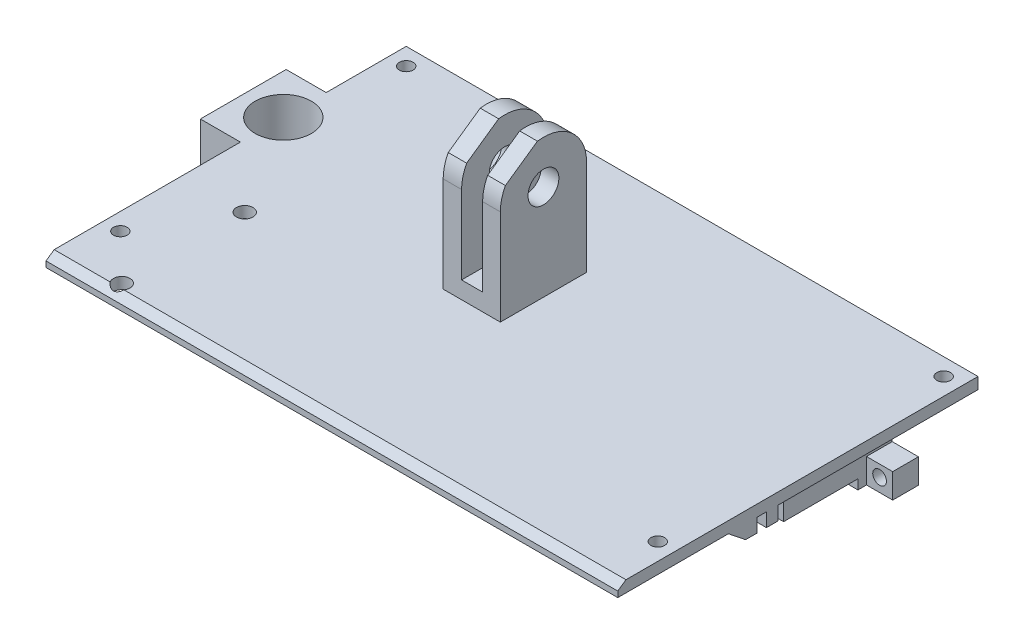
from build123d import *

# Parameters (mm, degrees)
EXTRUDE_1_DEPTH      = 3.1
SKETCH_2_W           = 3.1
SKETCH_2_H           = 15.08
SKETCH_2_W_2         = 3.68
SKETCH_2_W_3         = 3.22
EXTRUDE_2_DEPTH      = 3
SKETCH_3_W           = 3.22
SKETCH_3_H           = 15.08
EXTRUDE_3_DEPTH      = 24
SKETCH_4_R           = 2.7
CUT_EXTRUDE_1_DEPTH  = 24
SKETCH_5_W           = 90
SKETCH_5_H           = 40
SKETCH_5_W_2         = 10
SKETCH_5_H_2         = 15.08
EXTRUDE_4_DEPTH      = 2
EXTRUDE_START        = -2
EXTRUDE_6_DEPTH      = 20
CUT_EXTRUDE_2_DEPTH  = 18
SKETCH_8_W           = 2
SKETCH_8_H           = 2
EXTRUDE_8_DEPTH      = 2.4
SKETCH_9_W           = 33
SKETCH_9_H           = 2
SKETCH_9_W_2         = 3
EXTRUDE_9_DEPTH      = 2.4
SKETCH_10_W          = 2
SKETCH_10_H          = 1.65
SKETCH_10_W_2        = 10
SKETCH_10_H_2        = 2
EXTRUDE_10_DEPTH     = 15.6
SKETCH_11_W          = 12
SKETCH_11_H          = 15
EXTRUDE_11_DEPTH     = 20
CUT_EXTRUDE_3_DEPTH  = 20
EXTRUDE_12_DEPTH     = 2
CUT_EXTRUDE_4_DEPTH  = 3.65
SKETCH_15_W          = 10
SKETCH_15_H          = 15.6
CUT_EXTRUDE_5_DEPTH  = 3.65
SKETCH_17_W          = 20
SKETCH_17_H          = 8
EXTRUDE_13_DEPTH     = 2
CUT_EXTRUDE_6_DEPTH  = 2
SKETCH_19_W          = 10
SKETCH_19_H          = 2.4
CUT_EXTRUDE_7_DEPTH  = 3.65
SKETCH_20_R          = 4.71
CUT_EXTRUDE_8_DEPTH  = 20
SKETCH_21_W          = 90
SKETCH_21_H          = 2
EXTRUDE_14_DEPTH     = 10
EXTRUDE_15_DEPTH     = 10
CUT_EXTRUDE_9_DEPTH  = 2
SKETCH_24_W          = 4.58
SKETCH_24_H          = 4.62
SKETCH_24_R          = 1.2
EXTRUDE_16_DEPTH     = 4.5
SKETCH_25_W          = 4.58
SKETCH_25_H          = 4.62
SKETCH_25_R          = 1.2
EXTRUDE_17_DEPTH     = 4.5
SKETCH_26_W          = 2
SKETCH_26_H          = 1.69
EXTRUDE_18_DEPTH     = 6
SKETCH_27_W          = 4.5
SKETCH_27_H          = 3
CUT_EXTRUDE_10_DEPTH = 10
SKETCH_28_W          = 0.5
SKETCH_28_H          = 3
EXTRUDE_19_DEPTH     = 10
SKETCH_29_R          = 4.91
SKETCH_29_R_2        = 4.71
CUT_EXTRUDE_11_DEPTH = 76.91039191
EXTRUDE_20_DEPTH     = 2
SKETCH_34_W          = 4.58
SKETCH_34_H          = 4.5
CUT_EXTRUDE_12_DEPTH = 0.3
CUT_EXTRUDE_13_DEPTH = 0.3
SKETCH_36_W          = 80
SKETCH_36_H          = 7
EXTRUDE_21_DEPTH     = 2
SKETCH_37_R          = 1.45
CUT_EXTRUDE_14_DEPTH = 2
CUT_EXTRUDE_15_DEPTH = 116.616132092
EXTRUDE_22_DEPTH     = 80


with BuildPart() as part:
    # 草图1 → 凸台-拉伸1 (new body)
    with BuildSketch(Plane(origin=(0, 0, 0), x_dir=(0, 0, -1), z_dir=(1, 0, 0))):
        with BuildLine():
            ThreePointArc((2.7, 0), (1.909188309, -1.909188309), (0, -2.7))
            Line((0, -2.7), (0, -7.54))
            ThreePointArc((0, -7.54), (5.33158513, -5.33158513), (7.54, 0))
            Line((7.54, 0), (2.7, 0))
        make_face()
        with BuildLine():
            Line((0, -7.54), (0, -2.7))
            ThreePointArc((0, -2.7), (-1.909188309, -1.909188309), (-2.7, 0))
            Line((-2.7, 0), (-7.54, 0))
            ThreePointArc((-7.54, 0), (-5.33158513, -5.33158513), (0, -7.54))
        make_face()
        with BuildLine():
            ThreePointArc((2.7, 0), (1.909188309, -1.909188309), (0, -2.7))
            Line((0, -2.7), (0, -7.54))
            ThreePointArc((0, -7.54), (5.33158513, -5.33158513), (7.54, 0))
            Line((7.54, 0), (2.7, 0))
        make_face()
        with BuildLine():
            Line((0, -7.54), (0, -2.7))
            ThreePointArc((0, -2.7), (-1.909188309, -1.909188309), (-2.7, 0))
            Line((-2.7, 0), (-7.54, 0))
            ThreePointArc((-7.54, 0), (-5.33158513, -5.33158513), (0, -7.54))
        make_face()
        with BuildLine():
            Line((0, -13.7), (0, -7.54))
            ThreePointArc((0, -7.54), (-5.33158513, -5.33158513), (-7.54, 0))
            Line((-7.54, 0), (-7.54, -13.7))
            Line((-7.54, -13.7), (0, -13.7))
        make_face()
        with BuildLine():
            ThreePointArc((-2.7, 0), (0, 2.7), (2.7, 0))
            Line((2.7, 0), (7.54, 0))
            ThreePointArc((7.54, 0), (0, 7.54), (-7.54, 0))
            Line((-7.54, 0), (-2.7, 0))
        make_face()
        with BuildLine():
            ThreePointArc((7.54, 0), (5.33158513, -5.33158513), (0, -7.54))
            Line((0, -7.54), (0, -13.7))
            Line((0, -13.7), (7.54, -13.7))
            Line((7.54, -13.7), (7.54, 0))
        make_face()
    extrude(amount=EXTRUDE_1_DEPTH)

    # 草图2 → 凸台-拉伸2 (add)
    with BuildSketch(Plane.XZ.offset(13.7)):
        with Locations((1.55, 0)):
            Rectangle(SKETCH_2_W, SKETCH_2_H)
        with Locations((-1.84, 0)):
            Rectangle(SKETCH_2_W_2, SKETCH_2_H)
        with Locations((-5.29, 0)):
            Rectangle(SKETCH_2_W_3, SKETCH_2_H)
    extrude(amount=EXTRUDE_2_DEPTH)

    # 草图3 → 凸台-拉伸3 (add)
    with BuildSketch(Plane(origin=(0, -13.7, 0), x_dir=(1, 0, 0), z_dir=(0, 1, 0))):
        with Locations((-5.29, 0)):
            Rectangle(SKETCH_3_W, SKETCH_3_H)
    extrude(amount=EXTRUDE_3_DEPTH)

    # 草图4 → 切除-拉伸1 (cut)
    with BuildSketch(Plane.ZY.offset(6.9)):
        with BuildLine():
            ThreePointArc((-7.54, 0), (0, 7.54), (7.54, 0))
            Line((7.54, 0), (7.54, 10.3))
            Line((7.54, 10.3), (-7.54, 10.3))
            Line((-7.54, 10.3), (-7.54, 0))
        make_face()
        Circle(SKETCH_4_R)
    extrude(amount=-CUT_EXTRUDE_1_DEPTH, mode=Mode.SUBTRACT)

    # 草图5 → 凸台-拉伸4 (add)
    # profile 1 of 3: a face of its own
    with BuildSketch(Plane.XZ.offset(16.7)):
        with Locations((-1.9, 0)):
            Rectangle(SKETCH_5_W, SKETCH_5_H)
        with Locations((-1.9, 0)):
            Rectangle(SKETCH_5_W_2, SKETCH_5_H_2, mode=Mode.SUBTRACT)
    # profile 2 of 3: a face of its own
    with BuildSketch(Plane.XZ.offset(16.7)):
        Polygon((-6.9, 7.54), (3.1, -7.54), (-6.9, -7.54), align=None)
    # profile 3 of 3: a face of its own
    with BuildSketch(Plane.XZ.offset(16.7)):
        Polygon((-6.9, 7.54), (3.1, -7.54), (3.1, 7.54), align=None)
    extrude(amount=EXTRUDE_4_DEPTH)

    # 草图6 → 凸台-拉伸6 (add)
    with BuildSketch(Plane.XZ.offset(18.7).offset(EXTRUDE_START)):
        Polygon((-41.9, -20), (-39.9, -20), (-39.9, 1), (36.1, 1), (36.1, -20), (38.1, -20), (38.1, 3), (-41.9, 3), align=None)
        Polygon((36.1, -20), (-39.9, -20), (-41.9, -20), (-41.9, -22), (38.1, -22), (38.1, -20), align=None)
    extrude(amount=EXTRUDE_6_DEPTH)

    # 草图7 → 切除-拉伸2 (cut)
    with BuildSketch(Plane.XZ.offset(36.7)):
        Polygon((38.1, -7), (38.1, 3), (28.1, 3), (28.1, 1), (36.1, 1), (36.1, -7), align=None)
        Polygon((-39.9, -12), (-41.9, -12), (-41.9, -22), (-31.9, -22), (-31.9, -20), (-39.9, -20), align=None)
    extrude(amount=-CUT_EXTRUDE_2_DEPTH, mode=Mode.SUBTRACT)

    # 草图8 → 凸台-拉伸8 (add)
    with BuildSketch(Plane.XZ.offset(18.7)):
        Polygon((-43.9, 12.65), (-41.9, 12.65), (8.1, 12.65), (10.1, 12.65), (10.1, 14.65), (-43.9, 14.65), align=None)
        Polygon((-41.9, 11), (-41.9, 9), (10.1, 9), (10.1, 11), (8.1, 11), align=None)
        with Locations((-42.9, 10)):
            Rectangle(SKETCH_8_W, SKETCH_8_H)
    extrude(amount=EXTRUDE_8_DEPTH)

    # 草图9 → 凸台-拉伸9 (add)
    with BuildSketch(Plane.XZ.offset(21.1)):
        with Locations((26.6, 13.65)):
            Rectangle(SKETCH_9_W, SKETCH_9_H)
        with Locations((26.6, 10)):
            Rectangle(SKETCH_9_W, SKETCH_9_H)
        with Locations((-45.4, 13.65)):
            Rectangle(SKETCH_9_W_2, SKETCH_9_H)
        with Locations((-45.4, 10)):
            Rectangle(SKETCH_9_W_2, SKETCH_9_H)
    extrude(amount=-EXTRUDE_9_DEPTH)

    # 草图10 → 凸台-拉伸10 (add)
    with BuildSketch(Plane.XZ.offset(21.1)):
        Polygon((-26.9, 14.65), (-36.9, 14.65), (-36.9, 12.65), (-34.9, 12.65), (-26.9, 12.65), align=None)
        with Locations((-35.9, 11.825)):
            Rectangle(SKETCH_10_W, SKETCH_10_H)
        Polygon((-34.9, 11), (-36.9, 11), (-36.9, 9), (-26.9, 9), (-26.9, 11), align=None)
        with Locations((-41.9, 13.65)):
            Rectangle(SKETCH_10_W_2, SKETCH_10_H_2)
        with Locations((-41.9, 10)):
            Rectangle(SKETCH_10_W_2, SKETCH_10_H_2)
    extrude(amount=EXTRUDE_10_DEPTH)

    # 草图11 → 凸台-拉伸11 (add)
    with BuildSketch(Plane.XZ.offset(36.7)):
        with Locations((-47.9, -4.5)):
            Rectangle(SKETCH_11_W, SKETCH_11_H)
    extrude(amount=-EXTRUDE_11_DEPTH)

    # 草图12 → 切除-拉伸3 (cut)
    with BuildSketch(Plane.XZ.offset(36.7)):
        with BuildLine():
            ThreePointArc((-49.7077396, -1.491707571), (-49.908292429, -7.3077396), (-44.0922604, -7.508292429))
            Line((-44.0922604, -7.508292429), (-49.7077396, -1.491707571))
        make_face()
        with BuildLine():
            Line((-49.7077396, -1.491707571), (-44.0922604, -7.508292429))
            ThreePointArc((-44.0922604, -7.508292429), (-43.125938961, -6.140026912), (-42.785, -4.5))
            ThreePointArc((-42.785, -4.5), (-45.259973088, -0.725938961), (-49.7077396, -1.491707571))
        make_face()
        with BuildLine():
            ThreePointArc((-49.7077396, -1.491707571), (-49.908292429, -7.3077396), (-44.0922604, -7.508292429))
            Line((-44.0922604, -7.508292429), (-49.7077396, -1.491707571))
        make_face()
        with BuildLine():
            Line((-49.7077396, -1.491707571), (-44.0922604, -7.508292429))
            ThreePointArc((-44.0922604, -7.508292429), (-43.125938961, -6.140026912), (-42.785, -4.5))
            ThreePointArc((-42.785, -4.5), (-45.259973088, -0.725938961), (-49.7077396, -1.491707571))
        make_face()
    extrude(amount=-CUT_EXTRUDE_3_DEPTH, mode=Mode.SUBTRACT)

    # 草图13 → 凸台-拉伸12 (add)
    with BuildSketch(Plane.XZ.offset(18.7)):
        Polygon((-41.9, -20), (-46.9, -20), (-46.9, -26), (43.1, -26), (43.1, -20), (38.1, -20), (38.1, -22), (-31.9, -22), (-41.9, -22), align=None)
    extrude(amount=-EXTRUDE_12_DEPTH)

    # 草图14 → 切除-拉伸4 (cut)
    with BuildSketch(Plane.XY.offset(14.65)):
        Polygon((-46.9, -36.7), (-36.9, -36.7), (-36.9, -21.1), (-36.9, -18.7), (-46.9, -18.7), align=None)
    extrude(amount=-CUT_EXTRUDE_4_DEPTH, mode=Mode.SUBTRACT)

    # 草图15 → 切除-拉伸5 (cut)
    with BuildSketch(Plane.XY.offset(14.65)):
        with Locations((-31.9, -28.9)):
            Rectangle(SKETCH_15_W, SKETCH_15_H)
    extrude(amount=-CUT_EXTRUDE_5_DEPTH, mode=Mode.SUBTRACT)

    # 草图17 → 凸台-拉伸13 (add)
    with BuildSketch(Plane.XY.offset(11)):
        with Locations((-36.9, -40.7)):
            Rectangle(SKETCH_17_W, SKETCH_17_H)
    extrude(amount=-EXTRUDE_13_DEPTH)

    # 草图18 → 切除-拉伸6 (cut)
    with BuildSketch(Plane.XY.offset(11)):
        with BuildLine():
            ThreePointArc((-35.9, -19.5), (-37.35, -20.95), (-35.9, -22.4))
            Line((-35.9, -22.4), (-35.9, -19.5))
        make_face()
        with BuildLine():
            Line((-35.9, -19.5), (-35.9, -22.4))
            ThreePointArc((-35.9, -22.4), (-34.874695167, -21.975304833), (-34.45, -20.95))
            ThreePointArc((-34.45, -20.95), (-34.874695167, -19.924695167), (-35.9, -19.5))
        make_face()
        with BuildLine():
            ThreePointArc((-35.9, -19.5), (-37.35, -20.95), (-35.9, -22.4))
            Line((-35.9, -22.4), (-35.9, -19.5))
        make_face()
        with BuildLine():
            Line((-35.9, -19.5), (-35.9, -22.4))
            ThreePointArc((-35.9, -22.4), (-34.874695167, -21.975304833), (-34.45, -20.95))
            ThreePointArc((-34.45, -20.95), (-34.874695167, -19.924695167), (-35.9, -19.5))
        make_face()
        with BuildLine():
            ThreePointArc((-35.9, -41), (-37.35, -42.45), (-35.9, -43.9))
            Line((-35.9, -43.9), (-35.9, -41))
        make_face()
        with BuildLine():
            Line((-35.9, -41), (-35.9, -43.9))
            ThreePointArc((-35.9, -43.9), (-34.874695167, -43.475304833), (-34.45, -42.45))
            ThreePointArc((-34.45, -42.45), (-34.874695167, -41.424695167), (-35.9, -41))
        make_face()
        with BuildLine():
            ThreePointArc((-35.9, -41), (-37.35, -42.45), (-35.9, -43.9))
            Line((-35.9, -43.9), (-35.9, -41))
        make_face()
        with BuildLine():
            Line((-35.9, -41), (-35.9, -43.9))
            ThreePointArc((-35.9, -43.9), (-34.874695167, -43.475304833), (-34.45, -42.45))
            ThreePointArc((-34.45, -42.45), (-34.874695167, -41.424695167), (-35.9, -41))
        make_face()
    extrude(amount=-CUT_EXTRUDE_6_DEPTH, mode=Mode.SUBTRACT)

    # 草图19 → 切除-拉伸7 (cut)
    with BuildSketch(Plane.XY.offset(14.65)):
        with Locations((-31.9, -19.9)):
            Rectangle(SKETCH_19_W, SKETCH_19_H)
    extrude(amount=-CUT_EXTRUDE_7_DEPTH, mode=Mode.SUBTRACT)

    # 草图20 → 切除-拉伸8 (cut)
    with BuildSketch(Plane.XZ.offset(36.7)):
        with Locations(Location((-46.9, -4.5, 0), (0, 0, 270))):
            Circle(SKETCH_20_R)
    extrude(amount=-CUT_EXTRUDE_8_DEPTH, mode=Mode.SUBTRACT)

    # 草图21 → 凸台-拉伸14 (add)
    with BuildSketch(Plane.XY.offset(20)):
        with Locations((-1.9, -17.7)):
            Rectangle(SKETCH_21_W, SKETCH_21_H)
    extrude(amount=EXTRUDE_14_DEPTH)

    # 草图22 → 凸台-拉伸15 (add)
    with BuildSketch(Plane(origin=(43.1, 0, 0), x_dir=(0, 0, -1), z_dir=(1, 0, 0))):
        Polygon((26, -16.7), (-30, -16.7), (-30, -18.7), (-14.65, -18.7), (-14.65, -21.1), (-12.65, -21.1), (-12.65, -18.7), (-11, -18.7), (-11, -21.1), (-9, -21.1), (-9, -18.7), (26, -18.7), align=None)
    extrude(amount=EXTRUDE_15_DEPTH)

    # 草图23 → 切除-拉伸9 (cut)
    with BuildSketch(Plane.XZ.offset(18.7)):
        with BuildLine():
            ThreePointArc((49.251471863, -22.151471863), (49.251471863, -23.848528137), (50.948528137, -23.848528137))
            Line((50.948528137, -23.848528137), (49.251471863, -22.151471863))
        make_face()
        with BuildLine():
            Line((49.251471863, -22.151471863), (50.948528137, -23.848528137))
            ThreePointArc((50.948528137, -23.848528137), (51.208655439, -23.459220119), (51.3, -23))
            ThreePointArc((51.3, -23), (50.559220119, -21.891344561), (49.251471863, -22.151471863))
        make_face()
        with BuildLine():
            ThreePointArc((49.251471863, -22.151471863), (49.251471863, -23.848528137), (50.948528137, -23.848528137))
            Line((50.948528137, -23.848528137), (49.251471863, -22.151471863))
        make_face()
        with BuildLine():
            Line((49.251471863, -22.151471863), (50.948528137, -23.848528137))
            ThreePointArc((50.948528137, -23.848528137), (51.208655439, -23.459220119), (51.3, -23))
            ThreePointArc((51.3, -23), (50.559220119, -21.891344561), (49.251471863, -22.151471863))
        make_face()
        with BuildLine():
            ThreePointArc((51.3, 27), (51.208655439, 27.459220119), (50.948528137, 27.848528137))
            Line((50.948528137, 27.848528137), (49.251471863, 26.151471863))
            ThreePointArc((49.251471863, 26.151471863), (50.559220119, 25.891344561), (51.3, 27))
        make_face()
        with BuildLine():
            Line((49.251471863, 26.151471863), (50.948528137, 27.848528137))
            ThreePointArc((50.948528137, 27.848528137), (49.251471863, 27.848528137), (49.251471863, 26.151471863))
        make_face()
        with BuildLine():
            ThreePointArc((51.3, 27), (51.208655439, 27.459220119), (50.948528137, 27.848528137))
            Line((50.948528137, 27.848528137), (49.251471863, 26.151471863))
            ThreePointArc((49.251471863, 26.151471863), (50.559220119, 25.891344561), (51.3, 27))
        make_face()
        with BuildLine():
            Line((49.251471863, 26.151471863), (50.948528137, 27.848528137))
            ThreePointArc((50.948528137, 27.848528137), (49.251471863, 27.848528137), (49.251471863, 26.151471863))
        make_face()
        with BuildLine():
            ThreePointArc((-42.7, 27), (-43.440779881, 28.108655439), (-44.748528137, 27.848528137))
            Line((-44.748528137, 27.848528137), (-43.051471863, 26.151471863))
            ThreePointArc((-43.051471863, 26.151471863), (-42.791344561, 26.540779881), (-42.7, 27))
        make_face()
        with BuildLine():
            Line((-43.051471863, 26.151471863), (-44.748528137, 27.848528137))
            ThreePointArc((-44.748528137, 27.848528137), (-44.748528137, 26.151471863), (-43.051471863, 26.151471863))
        make_face()
        with BuildLine():
            ThreePointArc((-42.7, 27), (-43.440779881, 28.108655439), (-44.748528137, 27.848528137))
            Line((-44.748528137, 27.848528137), (-43.051471863, 26.151471863))
            ThreePointArc((-43.051471863, 26.151471863), (-42.791344561, 26.540779881), (-42.7, 27))
        make_face()
        with BuildLine():
            Line((-43.051471863, 26.151471863), (-44.748528137, 27.848528137))
            ThreePointArc((-44.748528137, 27.848528137), (-44.748528137, 26.151471863), (-43.051471863, 26.151471863))
        make_face()
        with BuildLine():
            ThreePointArc((-42.7, -23), (-43.440779881, -21.891344561), (-44.748528137, -22.151471863))
            Line((-44.748528137, -22.151471863), (-43.051471863, -23.848528137))
            ThreePointArc((-43.051471863, -23.848528137), (-42.791344561, -23.459220119), (-42.7, -23))
        make_face()
        with BuildLine():
            Line((-43.051471863, -23.848528137), (-44.748528137, -22.151471863))
            ThreePointArc((-44.748528137, -22.151471863), (-44.748528137, -23.848528137), (-43.051471863, -23.848528137))
        make_face()
        with BuildLine():
            ThreePointArc((-42.7, -23), (-43.440779881, -21.891344561), (-44.748528137, -22.151471863))
            Line((-44.748528137, -22.151471863), (-43.051471863, -23.848528137))
            ThreePointArc((-43.051471863, -23.848528137), (-42.791344561, -23.459220119), (-42.7, -23))
        make_face()
        with BuildLine():
            Line((-43.051471863, -23.848528137), (-44.748528137, -22.151471863))
            ThreePointArc((-44.748528137, -22.151471863), (-44.748528137, -23.848528137), (-43.051471863, -23.848528137))
        make_face()
    extrude(amount=-CUT_EXTRUDE_9_DEPTH, mode=Mode.SUBTRACT)

    # 草图24 → 凸台-拉伸16 (add)
    with BuildSketch(Plane(origin=(0, 0, -26), x_dir=(-1, 0, 0), z_dir=(0, 0, -1))):
        with Locations((-40.39, -21.01)):
            Rectangle(SKETCH_24_W, SKETCH_24_H)
        with Locations(Location((-40.39, -21.01, 0), (0, 0, 90))):
            Circle(SKETCH_24_R, mode=Mode.SUBTRACT)
    extrude(amount=-EXTRUDE_16_DEPTH)

    # 草图25 → 凸台-拉伸17 (add)
    with BuildSketch(Plane(origin=(0, 0, -26), x_dir=(-1, 0, 0), z_dir=(0, 0, -1))):
        with Locations((-40.39, -36.08)):
            Rectangle(SKETCH_25_W, SKETCH_25_H)
        with Locations(Location((-40.39, -36.08, 0), (0, 0, 90))):
            Circle(SKETCH_25_R, mode=Mode.SUBTRACT)
    extrude(amount=-EXTRUDE_17_DEPTH)

    # 草图26 → 凸台-拉伸18 (add)
    with BuildSketch(Plane(origin=(0, 0, -22), x_dir=(-1, 0, 0), z_dir=(0, 0, -1)).offset(EXTRUDE_START)):
        Polygon((-36.1, -18.7), (-38.1, -18.7), (-38.1, -23.32), (-38.1, -33.77), (-38.1, -36.7), (-36.1, -36.7), align=None)
        with Locations((-37.1, -37.545)):
            Rectangle(SKETCH_26_W, SKETCH_26_H)
    extrude(amount=EXTRUDE_18_DEPTH)

    # 草图27 → 切除-拉伸10 (cut)
    with BuildSketch(Plane(origin=(38.1, 0, 0), x_dir=(0, 0, -1), z_dir=(1, 0, 0))):
        with Locations((23.75, -24.82)):
            Rectangle(SKETCH_27_W, SKETCH_27_H)
    extrude(amount=-CUT_EXTRUDE_10_DEPTH, mode=Mode.SUBTRACT)

    # 草图28 → 凸台-拉伸19 (add)
    with BuildSketch(Plane(origin=(28.1, 0, 0), x_dir=(0, 0, -1), z_dir=(1, 0, 0))):
        with Locations((21.75, -24.82)):
            Rectangle(SKETCH_28_W, SKETCH_28_H)
    extrude(amount=EXTRUDE_19_DEPTH)

    # 草图29 → 切除-拉伸11 (cut, through all)
    with BuildSketch(Plane.XZ.offset(36.7)):
        with Locations(Location((-46.9, -4.5, 0), (0, 0, 270))):
            Circle(SKETCH_29_R)
        with Locations((-46.9, -4.5)):
            Circle(SKETCH_29_R_2, mode=Mode.SUBTRACT)
    extrude(amount=-CUT_EXTRUDE_11_DEPTH, mode=Mode.SUBTRACT)

    # 草图33 → 凸台-拉伸20 (add)
    with BuildSketch(Plane.XZ.offset(18.7)):
        with BuildLine():
            Line((-46.9, 37), (-46.9, 30))
            Line((-46.9, 30), (-35.9, 30))
            Line((-35.9, 30), (-35.9, 33.3))
            ThreePointArc((-35.9, 33.3), (-37.35, 34.75), (-35.9, 36.2))
            Line((-35.9, 36.2), (-35.9, 37))
            Line((-35.9, 37), (-46.9, 37))
        make_face()
        with BuildLine():
            Line((-35.9, 33.3), (-35.9, 30))
            Line((-35.9, 30), (-26.9, 30))
            Line((-26.9, 30), (-26.9, 37))
            Line((-26.9, 37), (-35.9, 37))
            Line((-35.9, 37), (-35.9, 36.2))
            ThreePointArc((-35.9, 36.2), (-34.874695167, 35.775304833), (-34.45, 34.75))
            ThreePointArc((-34.45, 34.75), (-34.874695167, 33.724695167), (-35.9, 33.3))
        make_face()
    extrude(amount=-EXTRUDE_20_DEPTH)

    # 草图34 → 切除-拉伸12 (cut)
    with BuildSketch(Plane(origin=(0, -33.77, 0), x_dir=(1, 0, 0), z_dir=(0, 1, 0))):
        with Locations((40.39, 23.75)):
            Rectangle(SKETCH_34_W, SKETCH_34_H)
    extrude(amount=-CUT_EXTRUDE_12_DEPTH, mode=Mode.SUBTRACT)

    # 草图35 → 切除-拉伸13 (cut)
    with BuildSketch(Plane.XZ.offset(23.32)):
        Polygon((38.1, -22), (36.1, -22), (36.1, -26), (42.68, -26), (42.68, -21.5), (38.1, -21.5), align=None)
    extrude(amount=-CUT_EXTRUDE_13_DEPTH, mode=Mode.SUBTRACT)

    # 草图36 → 凸台-拉伸21 (add)
    with BuildSketch(Plane.XZ.offset(18.7)):
        with Locations((13.1, 33.5)):
            Rectangle(SKETCH_36_W, SKETCH_36_H)
    extrude(amount=-EXTRUDE_21_DEPTH)

    # 草图37 → 切除-拉伸14 (cut)
    with BuildSketch(Plane.XZ.offset(18.7)):
        with Locations(Location((-35.9, 13.25, 0), (0, 0, 270))):
            Circle(SKETCH_37_R)
    extrude(amount=-CUT_EXTRUDE_14_DEPTH, mode=Mode.SUBTRACT)

    # 草图38 → 切除-拉伸15 (cut, through all)
    with BuildSketch(Plane.ZY.offset(46.9)):
        Polygon((37, -17.7), (37, -16.7), (35.571662303, -16.7), align=None)
        with BuildLine():
            ThreePointArc((6.654487216, 3.545334949), (5.644898214, 4.998672239), (4.32438096, 6.176676235))
            ThreePointArc((4.32438096, 6.176676235), (2.765671186, 7.014460983), (1.054624677, 7.465880175))
            Line((1.054624677, 7.465880175), (6.654487216, 3.545334949))
        make_face()
    extrude(amount=-CUT_EXTRUDE_15_DEPTH, mode=Mode.SUBTRACT)

    # 草图39 → 凸台-拉伸22 (add)
    with BuildSketch(Plane.ZY.offset(26.9)):
        Polygon((14.65, -18.7), (17.65, -18.7), (14.65, -21.1), align=None)
    extrude(amount=-EXTRUDE_22_DEPTH)


solid = part.part
